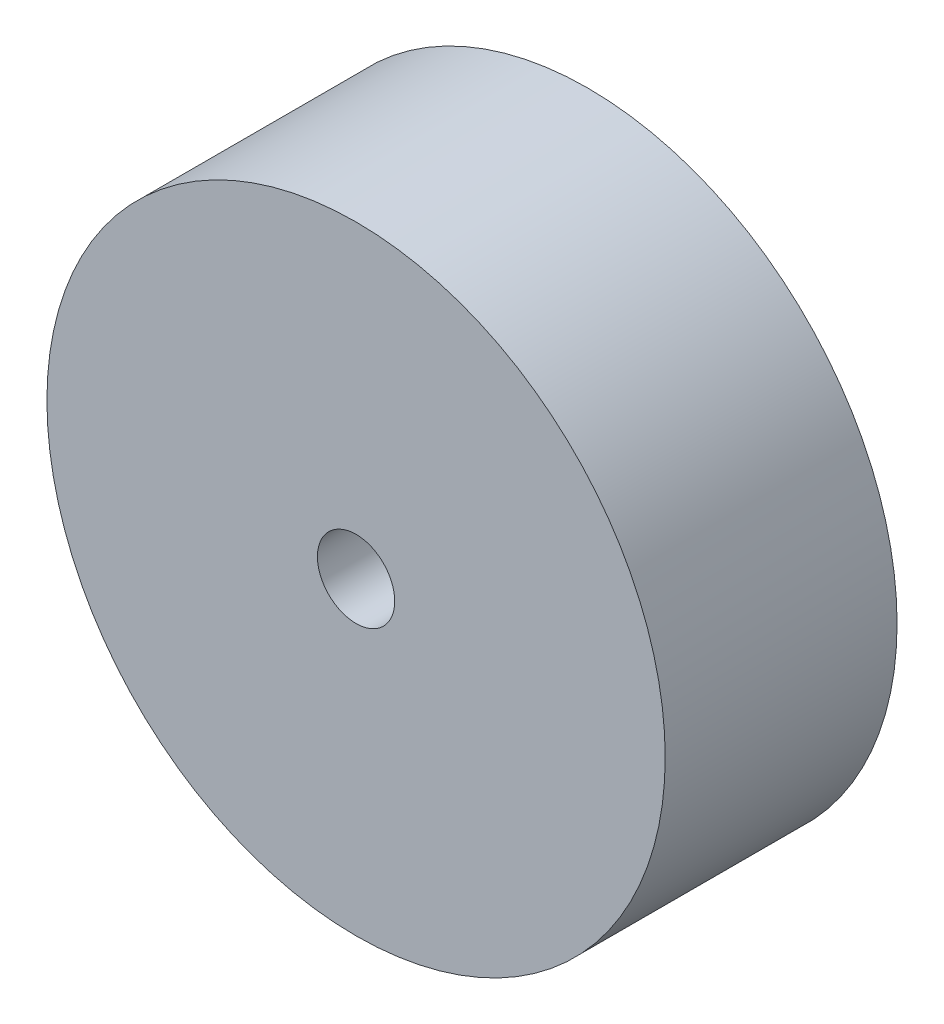
from build123d import *

# Parameters (mm, degrees)
SKETCH1_R           = 25.4
SKETCH1_R_2         = 3.175
BOSS_EXTRUDE1_DEPTH = 19.05


with BuildPart() as part:
    # Sketch1 → Boss-Extrude1 (new body)
    with BuildSketch(Plane.XY):
        with Locations(Location((0, 0, 0), (0, 0, 180))):
            Circle(SKETCH1_R)
        with Locations(Location((0, 0, 0), (0, 0, 180))):
            Circle(SKETCH1_R_2, mode=Mode.SUBTRACT)
    extrude(amount=BOSS_EXTRUDE1_DEPTH)


solid = part.part
